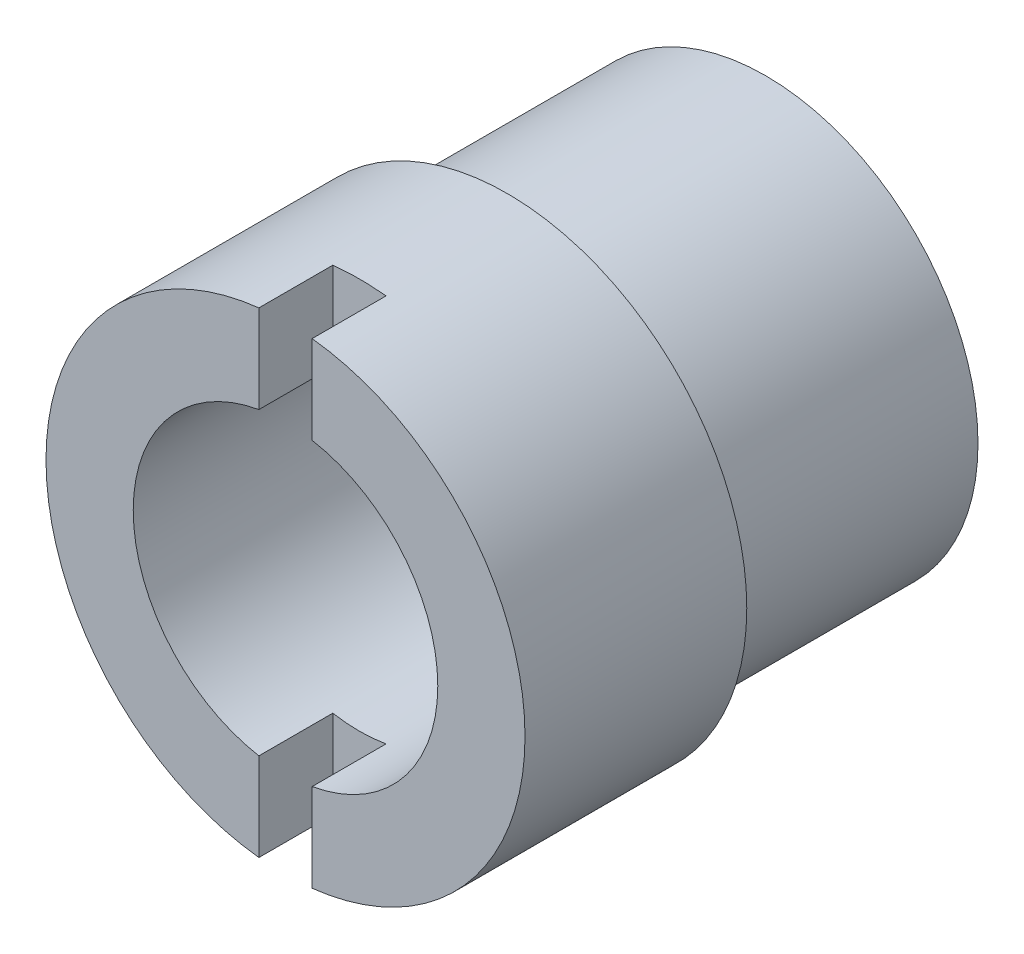
from build123d import *

# Parameters (mm, degrees)
SKETCH1_R           = 10.287
SKETCH1_R_2         = 6.5405
BOSS_EXTRUDE1_DEPTH = 9.525
SKETCH3_R           = 9.1186
SKETCH3_R_2         = 6.5405
BOSS_EXTRUDE3_DEPTH = 11.0998
SKETCH4_W           = 2.286
SKETCH4_H           = 3.175
CUT_EXTRUDE1_DEPTH  = 14.4399


with BuildPart() as part:
    # Sketch1 → Boss-Extrude1 (new body)
    with BuildSketch(Plane.XY):
        Circle(SKETCH1_R)
        Circle(SKETCH1_R_2, mode=Mode.SUBTRACT)
    extrude(amount=-BOSS_EXTRUDE1_DEPTH)

    # Sketch3 → Boss-Extrude3 (add)
    with BuildSketch(Plane(origin=(0, 0, -9.525), x_dir=(-1, 0, 0), z_dir=(0, 0, -1))):
        Circle(SKETCH3_R)
        with Locations(Location((0, 0, 0), (0, 0, 180))):
            Circle(SKETCH3_R_2, mode=Mode.SUBTRACT)
    extrude(amount=BOSS_EXTRUDE3_DEPTH)

    # Sketch4 → Cut-Extrude1 (cut, symmetric)
    with BuildSketch(Plane(origin=(0, 0, 0), x_dir=(1, 0, 0), z_dir=(0, 1, 0))):
        with Locations((0, 1.5875)):
            Rectangle(SKETCH4_W, SKETCH4_H)
    extrude(amount=CUT_EXTRUDE1_DEPTH, both=True, mode=Mode.SUBTRACT)


solid = part.part
